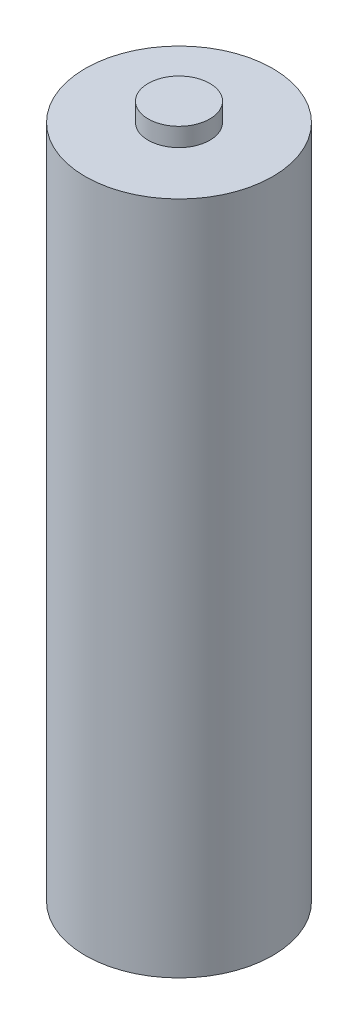
from build123d import *

# Parameters (mm, degrees)
SKETCH_1_R      = 9.125
EXTRUDE_1_DEPTH = 65.7
EXTRUDE_START   = -65.7
SKETCH_2_R      = 3
EXTRUDE_2_DEPTH = 67.5


with BuildPart() as part:
    # 草图1 → 凸台-拉伸1 (new body)
    with BuildSketch(Plane(origin=(0, 0, 0), x_dir=(1, 0, 0), z_dir=(0, 1, 0))):
        with Locations(Location((0, 0, 0), (0, 0, 270))):
            Circle(SKETCH_1_R)
    extrude(amount=EXTRUDE_1_DEPTH)

    # 草图2 → 凸台-拉伸2 (add)
    with BuildSketch(Plane(origin=(0, 65.7, 0), x_dir=(1, 0, 0), z_dir=(0, 1, 0)).offset(EXTRUDE_START)):
        with Locations(Location((0, 0, 0), (0, 0, 270))):
            Circle(SKETCH_2_R)
    extrude(amount=EXTRUDE_2_DEPTH)


solid = part.part
